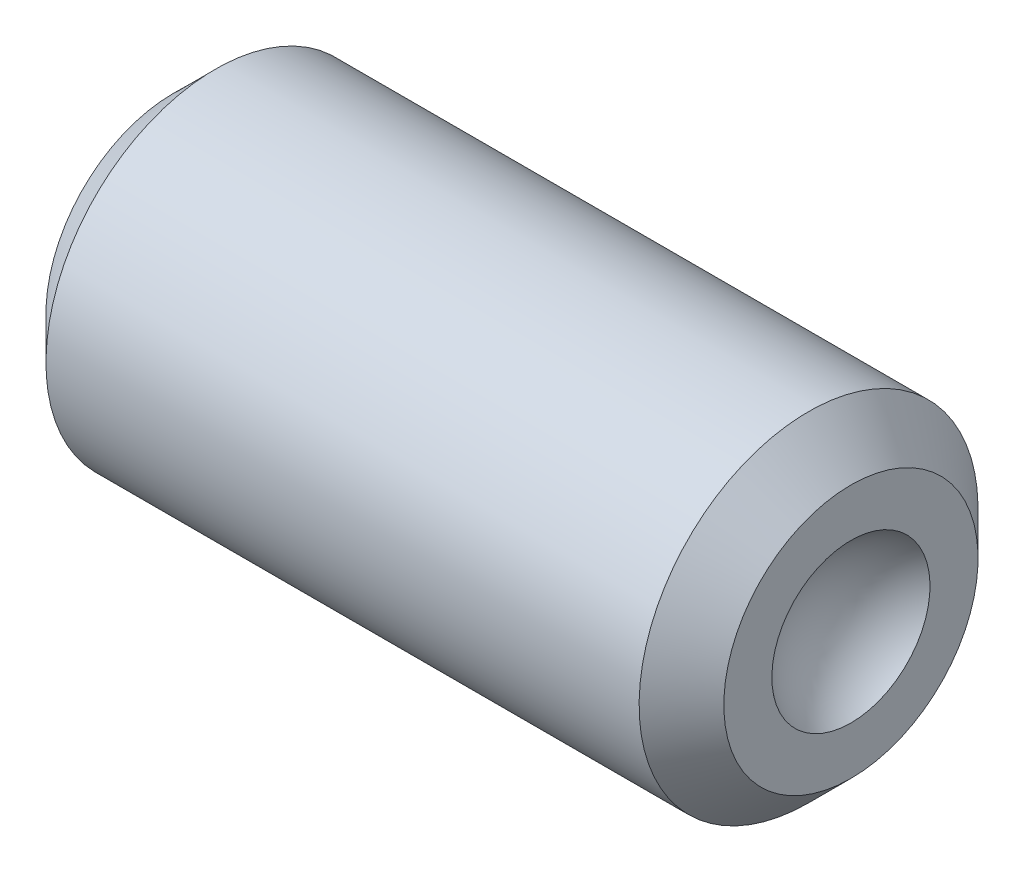
from build123d import *

# Parameters (mm, degrees)
CUT_EXTRUDE1_DEPTH = 4


with BuildPart() as part:
    # Sketch1 → Revolve1 (revolve)
    with BuildSketch(Plane.XY, mode=Mode.PRIVATE) as revolve1_sk:
        with BuildLine():
            Line((0, 0), (0, 1.125))
            Line((0, 1.125), (0.375, 1.5))
            Line((0.375, 1.5), (5.625, 1.5))
            Line((5.625, 1.5), (6, 1.125))
            Line((6, 1.125), (6, 0.7))
            ThreePointArc((6, 0.7), (5.724655592, 0.397059504), (5.625, 0))
            Line((5.625, 0), (0, 0))
        make_face()
    revolve(revolve1_sk.sketch.rotate(Axis((0, 0, 0), (1, 0, 0)), 180), axis=Axis((0, 0, 0), (1, 0, 0)))

    # Sketch2 → Cut-Extrude1 (cut)
    with BuildSketch(Plane.ZY):
        Polygon((0, 0.866025404), (-0.75, 0.433012702), (-0.75, -0.433012702), (0, -0.866025404), (0.75, -0.433012702), (0.75, 0.433012702), align=None)
    extrude(amount=-CUT_EXTRUDE1_DEPTH, mode=Mode.SUBTRACT)


solid = part.part
